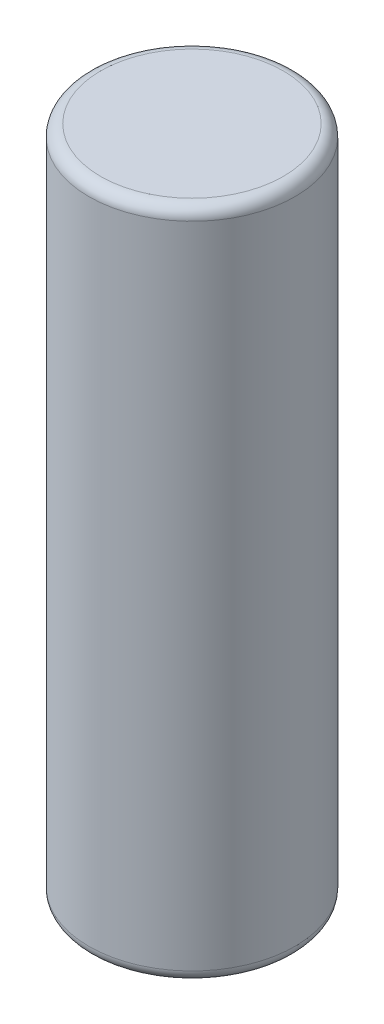
from build123d import *

# Parameters (mm, degrees)
SKETCH1_R           = 14.1
BOSS_EXTRUDE1_DEPTH = 92
FILLET1_R           = 1.6


with BuildPart() as part:
    # Sketch1 → Boss-Extrude1 (new body)
    with BuildSketch(Plane(origin=(0, 0, 0), x_dir=(1, 0, 0), z_dir=(0, 1, 0))):
        with Locations(Location((0, 0, 0), (0, 0, 270))):
            Circle(SKETCH1_R)
    extrude(amount=BOSS_EXTRUDE1_DEPTH)

    # Fillet1
    fillet1_edges = [part.edges().sort_by_distance(p)[0] for p in [
        (0, 0, -14.1),
        (0, 92, -14.1),
    ]]
    fillet(fillet1_edges, radius=FILLET1_R)


solid = part.part
